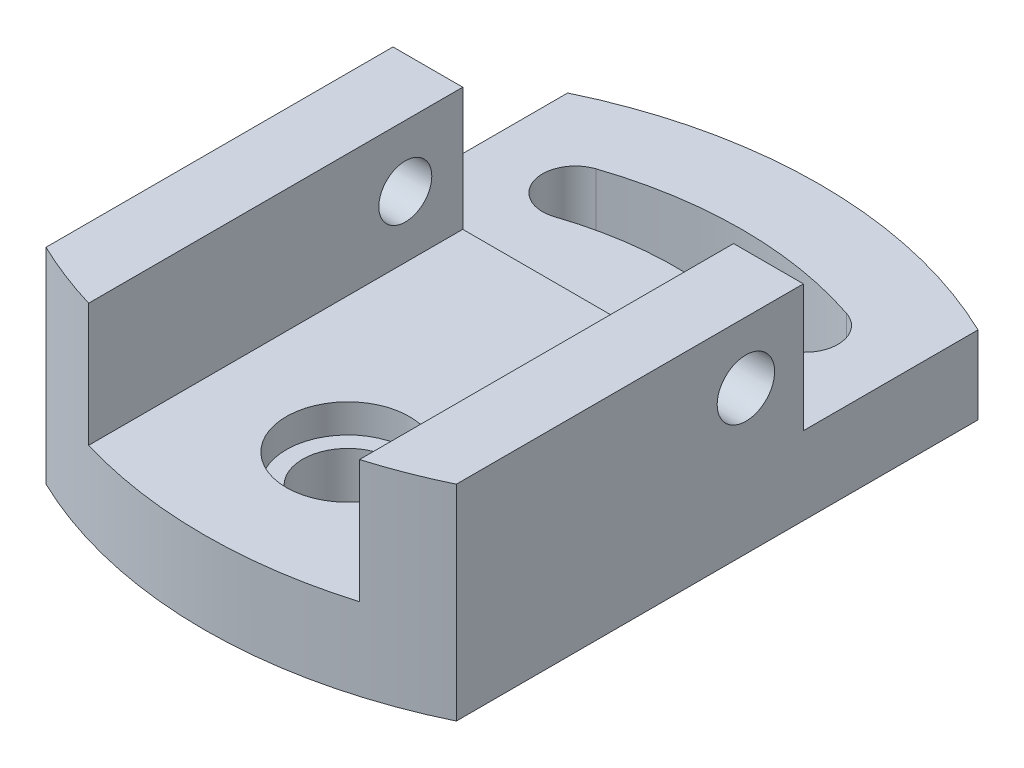
from build123d import *

# Parameters (mm, degrees)
BOSS_EXTRUDE1_DEPTH   = 50
BOSS_EXTRUDE1_2_DEPTH = 50
SKETCH1_3_R           = 15
BOSS_EXTRUDE2_DEPTH   = 20
BOSS_EXTRUDE3_DEPTH   = 19
SKETCH1_5_R           = 15
SKETCH1_5_R_2         = 11
BOSS_EXTRUDE4_DEPTH   = 13


with BuildPart() as part:
    # Sketch1 → Boss-Extrude1 (new body)
    with BuildSketch(Plane(origin=(0, 0, 0), x_dir=(1, 0, 0), z_dir=(0, 1, 0))):
        with BuildLine():
            Line((-33, 61), (-50, 61))
            Line((-50, 61), (-50, -23.561575886))
            ThreePointArc((-50, -23.561575886), (-41.631074926, -27.200063435), (-33, -30.163514831))
            Line((-33, -30.163514831), (-33, 61))
        make_face()
    extrude(amount=BOSS_EXTRUDE1_DEPTH)



with BuildPart() as body_2:
    # Sketch1 → Boss-Extrude1 2 (new body)
    with BuildSketch(Plane(origin=(0, 0, 0), x_dir=(1, 0, 0), z_dir=(0, 1, 0))):
        with BuildLine():
            Line((50, -23.561575886), (50, 61))
            Line((50, 61), (33, 61))
            Line((33, 61), (33, -30.163514831))
            ThreePointArc((33, -30.163514831), (41.631074926, -27.200063435), (50, -23.561575886))
        make_face()
    extrude(amount=BOSS_EXTRUDE1_2_DEPTH)


with BuildPart() as part_1:
    add(part.part)

    add(body_2.part)  # Boss-Extrude2 merges body 2
    # Sketch1<3> → Boss-Extrude2 (add)
    with BuildSketch(Plane(origin=(0, 0, 0), x_dir=(1, 0, 0), z_dir=(0, 1, 0))):
        with BuildLine():
            Line((33, 61), (-33, 61))
            Line((-33, 61), (-33, -30.163514831))
            ThreePointArc((-33, -30.163514831), (0, -35), (33, -30.163514831))
            Line((33, -30.163514831), (33, 61))
        make_face()
        Circle(SKETCH1_3_R, mode=Mode.SUBTRACT)
    extrude(amount=BOSS_EXTRUDE2_DEPTH)

    # Sketch1<4> → Boss-Extrude3 (add)
    with BuildSketch(Plane(origin=(0, 0, 0), x_dir=(1, 0, 0), z_dir=(0, 1, 0))):
        with BuildLine():
            ThreePointArc((50, 103.561575886), (0, 115), (-50, 103.561575886))
            Line((-50, 103.561575886), (-50, 61))
            Line((-50, 61), (-33, 61))
            Line((-33, 61), (33, 61))
            Line((33, 61), (50, 61))
            Line((50, 61), (50, 103.561575886))
        make_face()
        with BuildLine():
            ThreePointArc((-30.545454545, 91.010852136), (0, 96), (30.545454545, 91.010852136))
            ThreePointArc((30.545454545, 91.010852136), (35.584237678, 80.881159913), (25.454545455, 75.84237678))
            ThreePointArc((25.454545455, 75.84237678), (0, 80), (-25.454545455, 75.84237678))
            ThreePointArc((-25.454545455, 75.84237678), (-35.584237678, 80.881159913), (-30.545454545, 91.010852136))
        make_face(mode=Mode.SUBTRACT)
    extrude(amount=BOSS_EXTRUDE3_DEPTH)

    # Sketch1<5> → Boss-Extrude4 (add)
    with BuildSketch(Plane(origin=(0, 0, 0), x_dir=(1, 0, 0), z_dir=(0, 1, 0))):
        Circle(SKETCH1_5_R)
        Circle(SKETCH1_5_R_2, mode=Mode.SUBTRACT)
    extrude(amount=BOSS_EXTRUDE4_DEPTH)

    # Sketch3 → Cut-Revolve1 (revolve, cut)
    with BuildSketch(Plane(origin=(0, 35, 0), x_dir=(1, 0, 0), z_dir=(0, 1, 0))):
        Polygon((-50, 53.34), (50, 54), (50, 47), (-50, 47), align=None)
    revolve(axis=Axis((-50, 35, -47), (1, 0, 0)), mode=Mode.SUBTRACT)


solid = part_1.part
